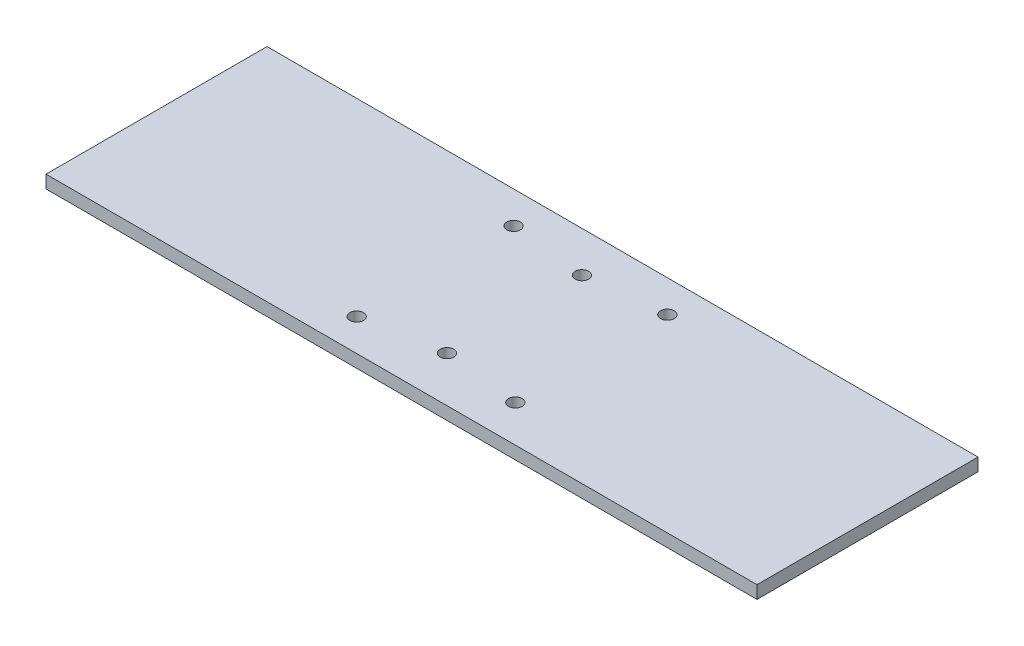
from build123d import *

# Parameters (mm, degrees)
SKETCH_1_W          = 166.48
SKETCH_1_H          = 51.75
EXTRUDE_1_DEPTH     = 3
SKETCH_3_R          = 1.6
CUT_EXTRUDE_2_DEPTH = 10
SKETCH_4_R          = 1.6
CUT_EXTRUDE_3_DEPTH = 10


with BuildPart() as part:
    # 草图1 → 凸台-拉伸1 (new body)
    with BuildSketch(Plane(origin=(0, 0, 0), x_dir=(1, 0, 0), z_dir=(0, 1, 0))):
        with Locations((0, 25.875)):
            Rectangle(SKETCH_1_W, SKETCH_1_H)
    extrude(amount=EXTRUDE_1_DEPTH)

    # 草图3 → 切除-拉伸2 (cut)
    with BuildSketch(Plane(origin=(0, 3, 0), x_dir=(1, 0, 0), z_dir=(0, 1, 0))):
        with Locations(Location((-18, 44.25, 0), (0, 0, 270))):
            Circle(SKETCH_3_R)
        with Locations(Location((0, 42.25, 0), (0, 0, 270))):
            Circle(SKETCH_3_R)
        with Locations(Location((18, 44.25, 0), (0, 0, 270))):
            Circle(SKETCH_3_R)
    extrude(amount=-CUT_EXTRUDE_2_DEPTH, mode=Mode.SUBTRACT)

    # 草图4 → 切除-拉伸3 (cut)
    with BuildSketch(Plane(origin=(0, 3, 0), x_dir=(1, 0, 0), z_dir=(0, 1, 0))):
        with Locations(Location((0, 10.65378949, 0), (0, 0, 270))):
            Circle(SKETCH_4_R)
        with Locations(Location((18, 8.65378949, 0), (0, 0, 270))):
            Circle(SKETCH_4_R)
        with Locations(Location((-18, 7.5, 0), (0, 0, 270))):
            Circle(SKETCH_4_R)
    extrude(amount=-CUT_EXTRUDE_3_DEPTH, mode=Mode.SUBTRACT)


solid = part.part
